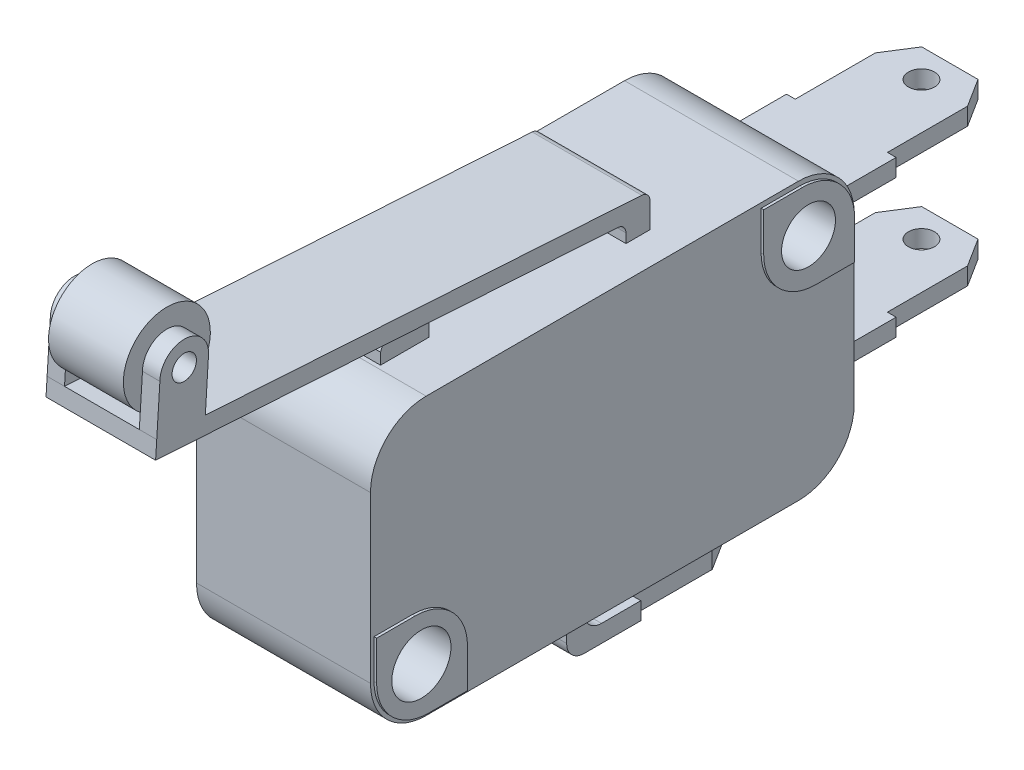
from build123d import *
from build123d.topology import SkipClean

# Parameters (mm, degrees)
BLOCOBASE_DEPTH           = 5
SKFIXACAO_R               = 1.7
SKFIXACAO_R_2             = 1.55
FIXACAO_DEPTH             = 5.15
RESSALTOFIXACAO_START     = 0.15
RESSALTOFIXACAO_DEPTH     = 0.15
BOTAO_DEPTH               = 2.15
SKETCH5_W                 = 6.3
SKETCH5_H                 = 1
BASECONECTORNONC_DEPTH    = 10.5
DESENHOCONECTORNONC_DEPTH = 20.5
BASECONECTORCOM_DEPTH     = 3.15
DESENHOCONECTORCOM_DEPTH  = 1
BASECONTATO_DEPTH         = 3.15
SKAPOIOROLO_R             = 0.7
APOIOROLO_DEPTH           = 1
SKROLO_R                  = 2.5
ROLO_DEPTH                = 4.3


with BuildPart() as part:
    # skBlocoBase → BlocoBase (new, symmetric)
    with BuildSketch(Plane(origin=(0, 0, 0), x_dir=(0, 0, -1), z_dir=(1, 0, 0))):
        with BuildLine():
            Line((-10.7, 7.95), (10.7, 7.95))
            ThreePointArc((10.7, 7.95), (12.9627417, 7.0127417), (13.9, 4.75))
            Line((13.9, 4.75), (13.9, -4.75))
            ThreePointArc((13.9, -4.75), (12.9627417, -7.0127417), (10.7, -7.95))
            Line((10.7, -7.95), (-10.7, -7.95))
            ThreePointArc((-10.7, -7.95), (-12.9627417, -7.0127417), (-13.9, -4.75))
            Line((-13.9, -4.75), (-13.9, 4.75))
            ThreePointArc((-13.9, 4.75), (-12.9627417, 7.0127417), (-10.7, 7.95))
        make_face()
    extrude(amount=BLOCOBASE_DEPTH, both=True)

    # skFixacao → Fixacao (cut, symmetric)
    with BuildSketch(Plane(origin=(0, 0, 0), x_dir=(0, 0, -1), z_dir=(1, 0, 0))):
        with Locations((-11.125, -5.1)):
            Circle(SKFIXACAO_R)
        with Locations((11.125, 5.1)):
            Circle(SKFIXACAO_R_2)
    extrude(amount=FIXACAO_DEPTH, both=True, mode=Mode.SUBTRACT)

    # skRessaltoFixacao → RessaltoFixacao (add)
    # profile 1 of 2: a face of its own
    with SkipClean():  # the faces are left unmerged after this step: merging them gives an invalid solid
        with BuildSketch(Plane(origin=(5, 0, 0), x_dir=(0, 0, -1), z_dir=(1, 0, 0)).offset(RESSALTOFIXACAO_START)):
            with BuildLine():
                ThreePointArc((-8.475, -5.525), (-9.353679656, -3.403679656), (-11.475, -2.525))
                Line((-11.475, -2.525), (-13.7, -2.525))
                Line((-13.7, -2.525), (-13.7, -4.75))
                ThreePointArc((-13.7, -4.75), (-12.821320344, -6.871320344), (-10.7, -7.75))
                Line((-10.7, -7.75), (-8.475, -7.75))
                Line((-8.475, -7.75), (-8.475, -5.525))
            make_face()
            with BuildLine():
                ThreePointArc((-9.789845005, -6.152312282), (-10.474438165, -6.670595205), (-11.325, -6.788194302))
                ThreePointArc((-11.325, -6.788194302), (-11.775561835, -3.529404795), (-9.789845005, -6.152312282))
            make_face(mode=Mode.SUBTRACT)
        # profile 2 of 2: a face of its own
        with BuildSketch(Plane(origin=(5, 0, 0), x_dir=(0, 0, -1), z_dir=(1, 0, 0)).offset(RESSALTOFIXACAO_START)):
            with BuildLine():
                ThreePointArc((13.775, 4.675), (12.896320344, 6.796320344), (10.775, 7.675))
                Line((10.775, 7.675), (8.55, 7.675))
                Line((8.55, 7.675), (8.55, 5.45))
                ThreePointArc((8.55, 5.45), (9.428679656, 3.328679656), (11.55, 2.45))
                Line((11.55, 2.45), (13.775, 2.45))
                Line((13.775, 2.45), (13.775, 4.675))
            make_face()
            with BuildLine():
                ThreePointArc((12.353274612, 4.1545681), (11.71815932, 3.667986725), (10.925, 3.562957385))
                ThreePointArc((10.925, 3.562957385), (10.53184068, 6.532013275), (12.353274612, 4.1545681))
            make_face(mode=Mode.SUBTRACT)
        ressaltofixacao = extrude(amount=-RESSALTOFIXACAO_DEPTH)

    # MirrorRessaltoFixacao: RessaltoFixacao across plane
    with SkipClean():  # the faces are left unmerged after this step: merging them gives an invalid solid
        add(ressaltofixacao.mirror(Plane(origin=(0, 0, 0), x_dir=(0, 0, 1), z_dir=(1, 0, 0))))

    # skBotao → Botao (add, symmetric)
    with SkipClean():  # the faces are left unmerged after this step: merging them gives an invalid solid
        with BuildSketch(Plane(origin=(0, 0, 0), x_dir=(0, 0, -1), z_dir=(1, 0, 0))):
            with BuildLine():
                Line((-10.475, 7.95), (-10.475, 8.6))
                ThreePointArc((-10.475, 8.6), (-9.075, 9.6), (-7.675, 8.6))
                Line((-7.675, 8.6), (-7.675, 7.95))
                Line((-7.675, 7.95), (-10.475, 7.95))
            make_face()
        extrude(amount=BOTAO_DEPTH, both=True)

    # Sketch5 → BaseConectorNONC (add)
    with SkipClean():  # the faces are left unmerged after this step: merging them gives an invalid solid
        with BuildSketch(Plane(origin=(0, 0, -13.9), x_dir=(-1, 0, 0), z_dir=(0, 0, -1))):
            with Locations((0, -3.975)):
                Rectangle(SKETCH5_W, SKETCH5_H)
            with Locations((0, 3.975)):
                Rectangle(SKETCH5_W, SKETCH5_H)
        extrude(amount=BASECONECTORNONC_DEPTH)

    # skDesenhoConectorNONC → DesenhoConectorNONC (cut)
    with SkipClean():  # the faces are left unmerged after this step: merging them gives an invalid solid
        with BuildSketch(Plane.XZ.offset(4.475)):
            Polygon((2.65, -22.767142952), (1.616967042, -24.4), (3.15, -24.4), (3.15, -18.161236833), (2.65, -18.161236833), align=None)
            Polygon((-3.15, -24.4), (-1.616967042, -24.4), (-2.65, -22.767142952), (-2.65, -18.161236833), (-3.15, -18.161236833), align=None)
            with BuildLine():
                ThreePointArc((0, -22.017142952), (-0.75, -22.767142952), (0, -23.517142952))
                Line((0, -23.517142952), (0, -22.017142952))
            make_face()
            with BuildLine():
                Line((0, -22.017142952), (0, -23.517142952))
                ThreePointArc((0, -23.517142952), (0.530330086, -23.297473038), (0.75, -22.767142952))
                ThreePointArc((0.75, -22.767142952), (0.530330086, -22.236812866), (0, -22.017142952))
            make_face()
        extrude(amount=-DESENHOCONECTORNONC_DEPTH, mode=Mode.SUBTRACT)

    # skBaseConectorCOM → BaseConectorCOM (add, symmetric)
    with SkipClean():  # the faces are left unmerged after this step: merging them gives an invalid solid
        with BuildSketch(Plane(origin=(0, 0, 0), x_dir=(0, 0, -1), z_dir=(1, 0, 0))):
            with BuildLine():
                Line((9.725, -11.25), (0.225, -11.25))
                ThreePointArc((0.225, -11.25), (-0.482106781, -10.957106781), (-0.775, -10.25))
                Line((-0.775, -10.25), (-0.775, -7.95))
                Line((-0.775, -7.95), (0.225, -7.95))
                Line((0.225, -7.95), (0.225, -9.25))
                ThreePointArc((0.225, -9.25), (0.517893219, -9.957106781), (1.225, -10.25))
                Line((1.225, -10.25), (9.725, -10.25))
                Line((9.725, -10.25), (9.725, -11.25))
            make_face()
        extrude(amount=BASECONECTORCOM_DEPTH, both=True)

    # skDesenhoConectorCOM → DesenhoConectorCOM (cut)
    with SkipClean():  # the faces are left unmerged after this step: merging them gives an invalid solid
        with BuildSketch(Plane.XZ.offset(11.25)):
            Polygon((2.65, -8.092142952), (1.616967042, -9.725), (3.15, -9.725), (3.15, -3.486236833), (2.65, -3.486236833), align=None)
            with BuildLine():
                ThreePointArc((0, -7.342142952), (-0.75, -8.092142952), (0, -8.842142952))
                Line((0, -8.842142952), (0, -7.342142952))
            make_face()
            with BuildLine():
                Line((0, -7.342142952), (0, -8.842142952))
                ThreePointArc((0, -8.842142952), (0.530330086, -8.622473038), (0.75, -8.092142952))
                ThreePointArc((0.75, -8.092142952), (0.530330086, -7.561812866), (0, -7.342142952))
            make_face()
            Polygon((-3.15, -9.725), (-1.616967042, -9.725), (-2.65, -8.092142952), (-2.65, -3.486236833), (-3.15, -3.486236833), align=None)
        extrude(amount=-DESENHOCONECTORCOM_DEPTH, mode=Mode.SUBTRACT)

    # skBaseContato → BaseContato (add, symmetric)
    with SkipClean():  # the faces are left unmerged after this step: merging them gives an invalid solid
        with BuildSketch(Plane(origin=(0, 0, 0), x_dir=(0, 0, -1), z_dir=(1, 0, 0))):
            with BuildLine():
                Line((2.63302332, 7.95), (2.63302332, 8.486635004))
                ThreePointArc((2.63302332, 8.486635004), (2.497665983, 8.828739854), (2.164880406, 8.985619098))
                Line((2.164880406, 8.985619098), (-24.4, 10.681624431))
                Line((-24.4, 10.681624431), (-24.336285828, 11.679592619))
                Line((-24.336285828, 11.679592619), (3.545575005, 9.899506131))
                ThreePointArc((3.545575005, 9.899506131), (3.878360582, 9.742626887), (4.013717919, 9.400522037))
                Line((4.013717919, 9.400522037), (4.013717919, 7.95))
                Line((4.013717919, 7.95), (2.63302332, 7.95))
            make_face()
        extrude(amount=BASECONTATO_DEPTH, both=True)

    # skApoioRolo → ApoioRolo (add)
    with SkipClean():  # the faces are left unmerged after this step: merging them gives an invalid solid
        with BuildSketch(Plane(origin=(3.15, 0, 0), x_dir=(0, 0, -1), z_dir=(1, 0, 0))):
            with BuildLine():
                ThreePointArc((-21.354211514, 14.486814776), (-22.754211514, 15.886814776), (-24.154211514, 14.486814776))
                Line((-24.154211514, 14.486814776), (-24.336285828, 11.679592619))
                Line((-24.336285828, 11.679592619), (-22.939130364, 11.590392778))
                Line((-22.939130364, 11.590392778), (-21.541974901, 11.501192936))
                Line((-21.541974901, 11.501192936), (-21.365242034, 14.3114187))
                Line((-21.365242034, 14.3114187), (-21.354211514, 14.486814776))
            make_face()
            with Locations((-22.754211514, 14.486814776)):
                Circle(SKAPOIOROLO_R, mode=Mode.SUBTRACT)
        apoiorolo = extrude(amount=-APOIOROLO_DEPTH)

    # MirrorApoioRolo: ApoioRolo across plane
    with SkipClean():  # the faces are left unmerged after this step: merging them gives an invalid solid
        add(apoiorolo.mirror(Plane(origin=(0, 0, 0), x_dir=(0, 0, 1), z_dir=(1, 0, 0))))

    # skRolo → Rolo (add)
    with SkipClean():  # the faces are left unmerged after this step: merging them gives an invalid solid
        with BuildSketch(Plane.ZY.offset(-2.15)):
            with Locations(Location((22.754211514, 14.486814776, 0), (0, 0, 239.619073526))):
                Circle(SKROLO_R)
        extrude(amount=ROLO_DEPTH)


solid = part.part
